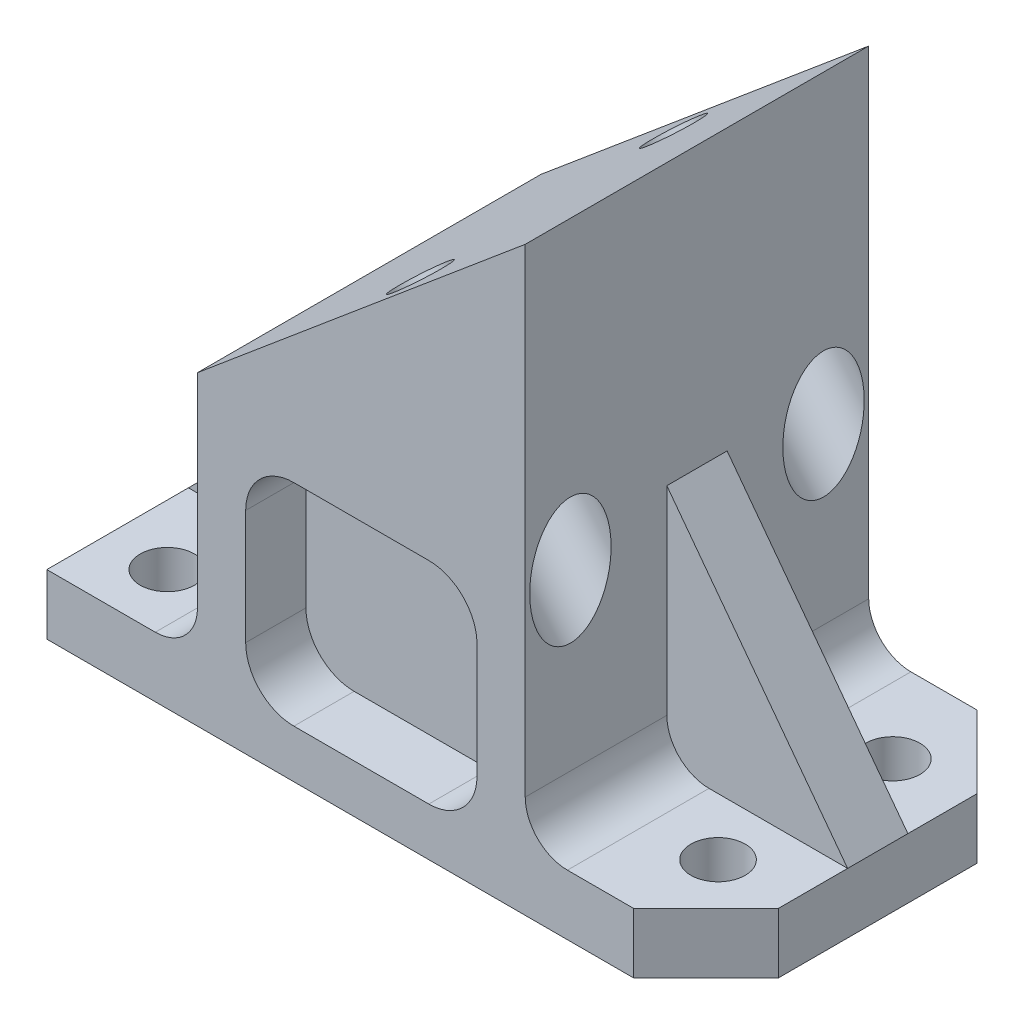
from build123d import *

# Parameters (mm, degrees)
BOSS_EXTRUDE1_DEPTH            = 57
SKETCH3_R                      = 4
CUT_EXTRUDE1_DEPTH             = 94.743374336
CBORE_FOR_M8_SHCS2_D           = 9
CBORE_FOR_M8_SHCS2_CBORE_D     = 13.5
CBORE_FOR_M8_SHCS2_CBORE_DEPTH = 20
SKETCH7_W                      = 30
SKETCH7_H                      = 57
BOSS_EXTRUDE2_DEPTH            = 10
BOSS_EXTRUDE3_DEPTH            = 5
BOSS_EXTRUDE3_DEPTH_BACK       = 5
SKETCH9_W                      = 25
SKETCH9_H                      = 57
BOSS_EXTRUDE4_DEPTH            = 10
BOSS_EXTRUDE5_DEPTH            = 5
BOSS_EXTRUDE5_DEPTH_BACK       = 5
CUT_EXTRUDE2_DEPTH             = 10
FILLET1_R                      = 7
CHAMFER1_SIZE                  = 12
M8_CLEARANCE_HOLE1_D           = 9


with BuildPart() as part:
    # Sketch2 → Boss-Extrude1 (new body)
    with BuildSketch(Plane.XY):
        Polygon((0, 0), (54.389155461, 45.637920288), (54.389155461, -50.8), (0, -50.8), align=None)
    extrude(amount=BOSS_EXTRUDE1_DEPTH)

    # Sketch3 → Cut-Extrude1 (cut, through all)
    with BuildSketch(Plane(origin=(0, 0, 0), x_dir=(0.7660444431189817, 0.6427876096865353, 0), z_dir=(-0.6427876096865353, 0.7660444431189817, 0))):
        with Locations(Location((38.5, -7.5, 0), (0, 0, 180))):
            Circle(SKETCH3_R)
        with Locations(Location((38.5, -49.5, 0), (0, 0, 180))):
            Circle(SKETCH3_R)
    extrude(amount=-CUT_EXTRUDE1_DEPTH, mode=Mode.SUBTRACT)

    # CBORE for M8 SHCS2 (through all)
    with Locations(Plane(origin=(32.139380484, -38.302222156, 0), x_dir=(0.7660444431189817, 0.6427876096865353, 0), z_dir=(0.6427876096865353, -0.7660444431189817, 0))):
        with Locations((38.5, 49.5), (38.5, 7.5)):
            CounterBoreHole(CBORE_FOR_M8_SHCS2_D / 2, CBORE_FOR_M8_SHCS2_CBORE_D / 2, CBORE_FOR_M8_SHCS2_CBORE_DEPTH)

    # Sketch7 → Boss-Extrude2 (add)
    with BuildSketch(Plane.XZ.offset(50.8)):
        with Locations((69.389155461, 28.5)):
            Rectangle(SKETCH7_W, SKETCH7_H)
    extrude(amount=-BOSS_EXTRUDE2_DEPTH)

    # Sketch8 → Boss-Extrude3 (add, two sides: drawn at the far end of the back side and taken through both)
    with BuildSketch(Plane.XY.offset(28.5).offset(-BOSS_EXTRUDE3_DEPTH_BACK)):
        Polygon((84.389155461, -40.8), (54.389155461, -0.8), (54.389155461, -40.8), align=None)
    extrude(amount=BOSS_EXTRUDE3_DEPTH + BOSS_EXTRUDE3_DEPTH_BACK)

    # Sketch9 → Boss-Extrude4 (add)
    with BuildSketch(Plane.XZ.offset(50.8)):
        with Locations((-12.5, 28.5)):
            Rectangle(SKETCH9_W, SKETCH9_H)
    extrude(amount=-BOSS_EXTRUDE4_DEPTH)

    # Sketch10 → Boss-Extrude5 (add, two sides: drawn at the far end of the back side and taken through both)
    with BuildSketch(Plane.XY.offset(28.5).offset(-BOSS_EXTRUDE5_DEPTH_BACK)):
        Polygon((-25, -40.8), (0, -15.8), (0, -40.8), align=None)
    extrude(amount=BOSS_EXTRUDE5_DEPTH + BOSS_EXTRUDE5_DEPTH_BACK)

    # Sketch11 → Cut-Extrude2 (cut)
    with BuildSketch(Plane(origin=(0, 0, 0), x_dir=(-1, 0, 0), z_dir=(0, 0, -1))):
        with BuildLine():
            Line((-38.389155461, -7.8), (-16, -7.8))
            ThreePointArc((-16, -7.8), (-10.343145751, -10.143145751), (-8, -15.8))
            Line((-8, -15.8), (-8, -34.8))
            ThreePointArc((-8, -34.8), (-10.343145751, -40.456854249), (-16, -42.8))
            Line((-16, -42.8), (-38.389155461, -42.8))
            ThreePointArc((-38.389155461, -42.8), (-44.046009711, -40.456854249), (-46.389155461, -34.8))
            Line((-46.389155461, -34.8), (-46.389155461, -15.8))
            ThreePointArc((-46.389155461, -15.8), (-44.046009711, -10.143145751), (-38.389155461, -7.8))
        make_face()
    cut_extrude2 = extrude(amount=-CUT_EXTRUDE2_DEPTH, mode=Mode.SUBTRACT)

    # Mirror1: Cut-Extrude2 across plane
    add(cut_extrude2.mirror(Plane.XY.offset(28.5)), mode=Mode.SUBTRACT)

    # Fillet1
    fillet1_edges = [part.edges().sort_by_distance(p)[0] for p in [
        (54.389155461, -40.8, 45.25),
        (54.389155461, -40.8, 11.75),
        (0, -40.8, 11.75),
        (0, -40.8, 45.25),
    ]]
    fillet(fillet1_edges, radius=FILLET1_R)

    # Chamfer1
    chamfer1_edges = [part.edges().sort_by_distance(p)[0] for p in [
        (84.389155461, -45.8, 57),
        (84.389155461, -45.8, 0),
    ]]
    chamfer(chamfer1_edges, length=CHAMFER1_SIZE)

    # M8 Clearance Hole1 (through all)
    with Locations(Plane(origin=(0, -40.8, 0), x_dir=(1, 0, 0), z_dir=(0, 1, 0))):
        with Locations((72.389155461, -43), (72.389155461, -14), (-15, -10), (-15, -47)):
            Hole(M8_CLEARANCE_HOLE1_D / 2)


solid = part.part
